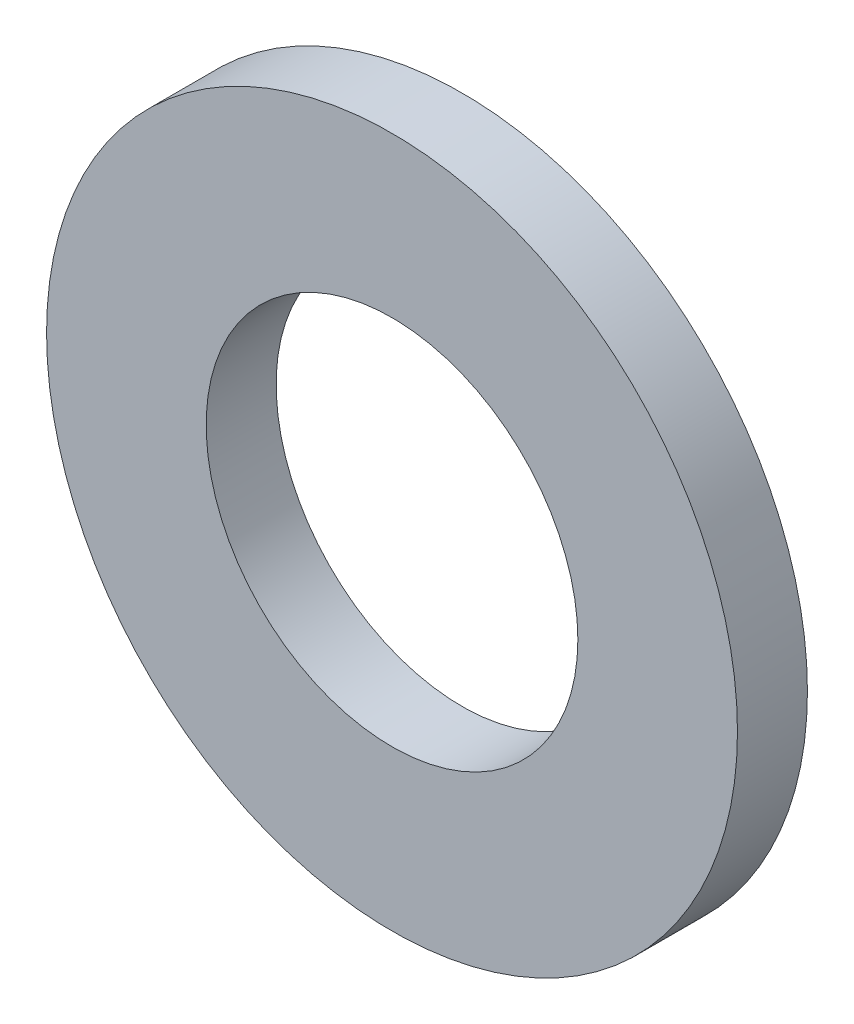
from build123d import *

# Parameters (mm, degrees)
SKETCH3_R           = 7.9
SKETCH3_R_2         = 4.25
BOSS_EXTRUDE1_DEPTH = 0.8


with BuildPart() as part:
    # Sketch3 → Boss-Extrude1 (new, symmetric)
    with BuildSketch(Plane.XY):
        Circle(SKETCH3_R)
        Circle(SKETCH3_R_2, mode=Mode.SUBTRACT)
    extrude(amount=BOSS_EXTRUDE1_DEPTH, both=True)


solid = part.part
